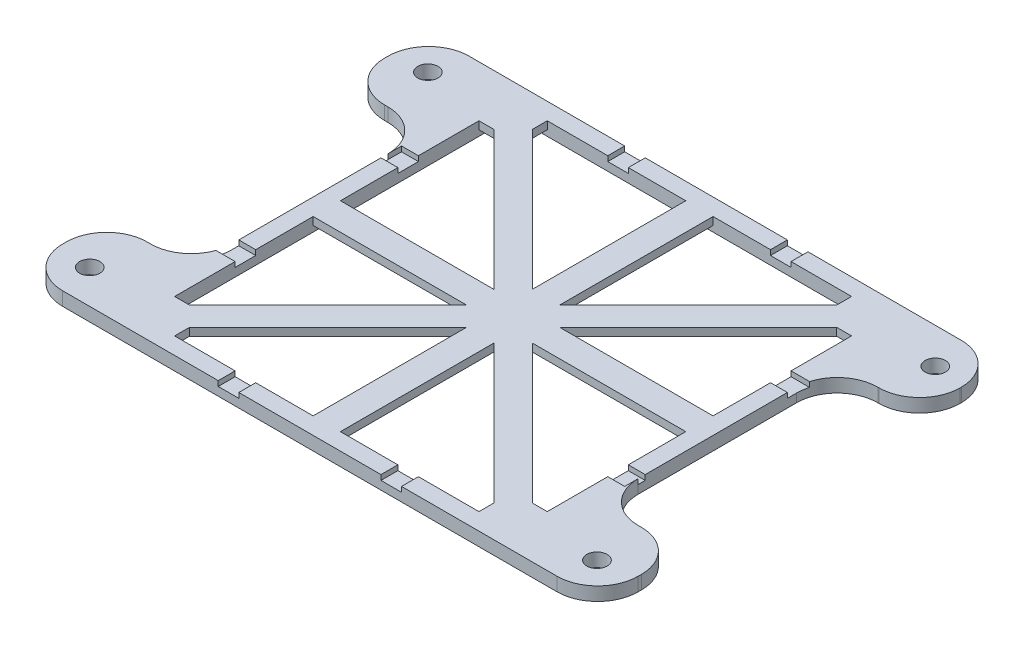
from build123d import *

# Parameters (mm, degrees)
SKETCH1_W           = 120.2
SKETCH1_H           = 120.2
SKETCH1_W_2         = 110.2
SKETCH1_H_2         = 110.2
BOSS_EXTRUDE1_DEPTH = 4
SKETCH2_W           = 10.1
SKETCH2_H           = 10.1
BOSS_EXTRUDE2_DEPTH = 2.3
SKETCH3_W           = 25
SKETCH3_H           = 25
SKETCH3_R           = 3
SKETCH3_W_2         = 24.35
SKETCH3_H_2         = 24.35
BOSS_EXTRUDE3_DEPTH = 4
FILLET1_R           = 12
SKETCH5_R           = 5.417288046
BOSS_EXTRUDE4_DEPTH = 10
CUT_EXTRUDE1_START  = -12.5
SKETCH4_W           = 6.076696642
SKETCH4_H           = 5
CUT_EXTRUDE1_DEPTH  = 10
CIRPATTERN1_COUNT   = 4
SKETCH6_R           = 22.094645404
CUT_EXTRUDE2_DEPTH  = 10
BOSS_EXTRUDE5_DEPTH = 2.3
SKETCH9_W           = 17.742485537
SKETCH9_H           = 24.263991122
SKETCH9_W_2         = 24.263991122
SKETCH9_H_2         = 17.742485537
CUT_EXTRUDE3_DEPTH  = 10


with BuildPart() as part:
    # Sketch1 → Boss-Extrude1 (new body)
    with BuildSketch(Plane(origin=(0, 0, 0), x_dir=(1, 0, 0), z_dir=(0, 1, 0))):
        Rectangle(SKETCH1_W, SKETCH1_H)
        Rectangle(SKETCH1_W_2, SKETCH1_H_2, mode=Mode.SUBTRACT)
    extrude(amount=BOSS_EXTRUDE1_DEPTH)

    # Sketch2 → Boss-Extrude2 (add)
    with BuildSketch(Plane(origin=(0, 4, 0), x_dir=(1, 0, 0), z_dir=(0, 1, 0))):
        with Locations((-50.05, 50.05)):
            Rectangle(SKETCH2_W, SKETCH2_H)
        with Locations((50.05, 50.05)):
            Rectangle(SKETCH2_W, SKETCH2_H)
        with Locations((50.05, -50.05)):
            Rectangle(SKETCH2_W, SKETCH2_H)
        with Locations((-50.05, -50.05)):
            Rectangle(SKETCH2_W, SKETCH2_H)
    extrude(amount=-BOSS_EXTRUDE2_DEPTH)

    # Sketch3 → Boss-Extrude3 (add)
    # profile 1 of 4: a face of its own
    with BuildSketch(Plane(origin=(0, 0, 0), x_dir=(-1, 0, 0), z_dir=(0, -1, 0))):
        with Locations((72.6, -47.6)):
            Rectangle(SKETCH3_W, SKETCH3_H)
        with Locations(Location((75.1, -50.1, 0), (0, 0, 90))):
            Circle(SKETCH3_R, mode=Mode.SUBTRACT)
    # profile 2 of 4: a face of its own
    with BuildSketch(Plane(origin=(0, 0, 0), x_dir=(-1, 0, 0), z_dir=(0, -1, 0))):
        with Locations((-72.6, -47.6)):
            Rectangle(SKETCH3_W, SKETCH3_H)
        with Locations(Location((-74.9, -50.1, 0), (0, 0, 90))):
            Circle(SKETCH3_R, mode=Mode.SUBTRACT)
    # profile 3 of 4: a face of its own
    with BuildSketch(Plane(origin=(0, 0, 0), x_dir=(-1, 0, 0), z_dir=(0, -1, 0))):
        with Locations((72.6, 47.6)):
            Rectangle(SKETCH3_W, SKETCH3_H)
        with Locations(Location((75.1, 49.9, 0), (0, 0, 90))):
            Circle(SKETCH3_R, mode=Mode.SUBTRACT)
    # profile 4 of 4: a face of its own
    with BuildSketch(Plane(origin=(0, 0, 0), x_dir=(-1, 0, 0), z_dir=(0, -1, 0))):
        with Locations((-72.275, 47.925)):
            Rectangle(SKETCH3_W_2, SKETCH3_H_2)
        with Locations(Location((-75.260238187, 49.598128293, 0), (0, 0, 90))):
            Circle(SKETCH3_R, mode=Mode.SUBTRACT)
    extrude(amount=-BOSS_EXTRUDE3_DEPTH)

    # Fillet1
    fillet1_edges = [part.edges().sort_by_distance(p)[0] for p in [
        (85.1, 2, 60.1),
        (85.1, 2, 35.1),
        (60.1, 2, 35.1),
        (84.45, 2, -60.1),
        (60.1, 2, -35.75),
        (84.45, 2, -35.75),
        (-60.1, 2, 35.1),
        (-85.1, 2, 35.1),
        (-85.1, 2, 60.1),
        (-60.1, 2, -35.1),
        (-85.1, 2, -60.1),
        (-85.1, 2, -35.1),
    ]]
    fillet(fillet1_edges, radius=FILLET1_R)

    # Sketch4 → Cut-Extrude1 (cut)
    with BuildSketch(Plane(origin=(0, 0, 0), x_dir=(-1, 0, 0), z_dir=(0, -1, 0)).offset(CUT_EXTRUDE1_START)):
        with BuildLine():
            Line((60.786291501, -27.1), (64.782340933, -27.1))
            Line((64.782340933, -27.1), (64.782340933, -21.023303358))
            Line((64.782340933, -21.023303358), (60.1, -21.023303358))
            Line((60.1, -21.023303358), (60.1, -23.1))
            ThreePointArc((60.1, -23.1), (60.272817284, -25.129223745), (60.786291501, -27.1))
        make_face()
        with BuildLine():
            Line((55.1, -27.1), (60.786291501, -27.1))
            ThreePointArc((60.786291501, -27.1), (60.272817284, -25.129223745), (60.1, -23.1))
            Line((60.1, -23.1), (60.1, -21.023303358))
            Line((60.1, -21.023303358), (55.1, -21.023303358))
            Line((55.1, -21.023303358), (55.1, -27.1))
        make_face()
        with Locations((24.061651679, -57.6)):
            Rectangle(SKETCH4_W, SKETCH4_H)
    cut_extrude1 = extrude(amount=CUT_EXTRUDE1_DEPTH, mode=Mode.SUBTRACT)

    # CirPattern1: Cut-Extrude1 ×4 about axis
    cirpattern1_axis = Axis((0, 0, 0), (0, 1, 0))
    for i in range(1, CIRPATTERN1_COUNT):
        add(cut_extrude1.rotate(cirpattern1_axis, i * 360 / CIRPATTERN1_COUNT), mode=Mode.SUBTRACT)

    # Sketch8 → Boss-Extrude5 (add)
    with BuildSketch(Plane(origin=(0, 1.7, 0), x_dir=(-1, 0, 0), z_dir=(0, -1, 0))):
        Polygon((50.704922644, -45), (9.738912133, -4.033989488), (4.033989488, -4.033989488), (4.033989488, -9.738912133), (45, -50.704922645), (45, -45), align=None)
        Polygon((4.033989488, -9.738912133), (0, -5.704922645), (-4.033989488, -9.738912133), (-4.033989488, -75.048460322), (4.033989488, -75.048460322), align=None)
        Polygon((-50.214813889, -55.919736534), (-4.033989488, -9.738912133), (-4.033989488, -4.033989488), (-9.738912133, -4.033989488), (-55.919736534, -50.214813889), align=None)
        Polygon((-9.738912133, -4.033989488), (-5.704922645, 0), (-9.738912133, 4.033989488), (-75.048460322, 4.033989488), (-75.048460322, -4.033989488), align=None)
        Polygon((-4.033989488, 4.033989488), (-4.033989488, 9.738912133), (-50.214813889, 55.919736534), (-55.919736534, 50.214813889), (-9.738912133, 4.033989488), align=None)
        Polygon((0, 5.704922645), (4.033989488, 9.738912133), (4.033989488, 75.048460322), (-4.033989488, 75.048460322), (-4.033989488, 9.738912133), align=None)
        Polygon((9.738912133, 4.033989488), (55.919736534, 50.214813889), (50.214813889, 55.919736534), (4.033989488, 9.738912133), (4.033989488, 4.033989488), align=None)
        Polygon((75.048460322, 4.033989488), (9.738912133, 4.033989488), (5.704922645, 0), (9.738912133, -4.033989488), (75.048460322, -4.033989488), align=None)
        Polygon((-4.033989488, -9.738912133), (0, -5.704922645), (-1.670933156, -4.033989488), (-4.033989488, -4.033989488), align=None)
        Polygon((4.033989488, -4.033989488), (1.670933156, -4.033989488), (0, -5.704922645), (4.033989488, -9.738912133), align=None)
        Polygon((9.738912133, -4.033989488), (5.704922645, 0), (4.033989488, -1.670933156), (4.033989488, -4.033989488), align=None)
        Polygon((5.704922645, 0), (9.738912133, 4.033989488), (4.033989488, 4.033989488), (4.033989488, 1.670933156), align=None)
        Polygon((1.670933156, 4.033989488), (4.033989488, 4.033989488), (4.033989488, 9.738912133), (0, 5.704922645), align=None)
        Polygon((-1.670933156, 4.033989488), (0, 5.704922645), (-4.033989488, 9.738912133), (-4.033989488, 4.033989488), align=None)
        Polygon((-5.704922645, 0), (-4.033989488, 1.670933156), (-4.033989488, 4.033989488), (-9.738912133, 4.033989488), align=None)
        Polygon((-9.738912133, -4.033989488), (-4.033989488, -4.033989488), (-4.033989488, -1.670933157), (-5.704922645, 0), align=None)
        Polygon((0, -5.704922645), (1.670933156, -4.033989488), (-1.670933156, -4.033989488), align=None)
        Polygon((4.033989488, -4.033989488), (4.033989488, -1.670933156), (1.670933156, -4.033989488), align=None)
        Polygon((4.033989488, -1.670933156), (5.704922645, 0), (4.033989488, 1.670933156), align=None)
        Polygon((4.033989488, 1.670933156), (4.033989488, 4.033989488), (1.670933156, 4.033989488), align=None)
        Polygon((-4.033989488, 1.670933156), (-1.670933156, 4.033989488), (-4.033989488, 4.033989488), align=None)
        Polygon((-4.033989488, -1.670933157), (-4.033989488, 1.670933156), (-5.704922645, 0), align=None)
        Polygon((-4.033989488, -4.033989488), (-1.670933156, -4.033989488), (-4.033989488, -1.670933157), align=None)
        Polygon((1.670933156, -4.033989488), (4.033989488, -1.670933156), (4.033989488, 1.670933156), (1.670933156, 4.033989488), (-1.670933156, 4.033989488), (-4.033989488, 1.670933156), (-4.033989488, -1.670933157), (-1.670933156, -4.033989488), align=None)
        Polygon((-1.670933156, 4.033989488), (1.670933156, 4.033989488), (0, 5.704922645), align=None)
    extrude(amount=-BOSS_EXTRUDE5_DEPTH)

    # Sketch9 → Cut-Extrude3 (cut)
    with BuildSketch(Plane(origin=(0, 1.7, 0), x_dir=(-1, 0, 0), z_dir=(0, -1, 0))):
        with Locations((1.428324636, -72.231995561)):
            Rectangle(SKETCH9_W, SKETCH9_H)
        with Locations((-72.231995561, -1.428324636)):
            Rectangle(SKETCH9_W_2, SKETCH9_H_2)
        with Locations((-1.428324636, 72.231995561)):
            Rectangle(SKETCH9_W, SKETCH9_H)
        with Locations((72.231995561, 1.428324636)):
            Rectangle(SKETCH9_W_2, SKETCH9_H_2)
    extrude(amount=-CUT_EXTRUDE3_DEPTH, mode=Mode.SUBTRACT)


with BuildPart() as body_2:
    # Sketch5 → Boss-Extrude4 (new body)
    with BuildSketch(Plane.XZ):
        with Locations(Location((0, 0, 0), (0, 0, 270))):
            Circle(SKETCH5_R)
    extrude(amount=BOSS_EXTRUDE4_DEPTH)

    # Sketch6 → Cut-Extrude2 (cut)
    with BuildSketch(Plane.XZ.offset(10)):
        Circle(SKETCH6_R)
    extrude(amount=-CUT_EXTRUDE2_DEPTH, mode=Mode.SUBTRACT)


solid = part.part
